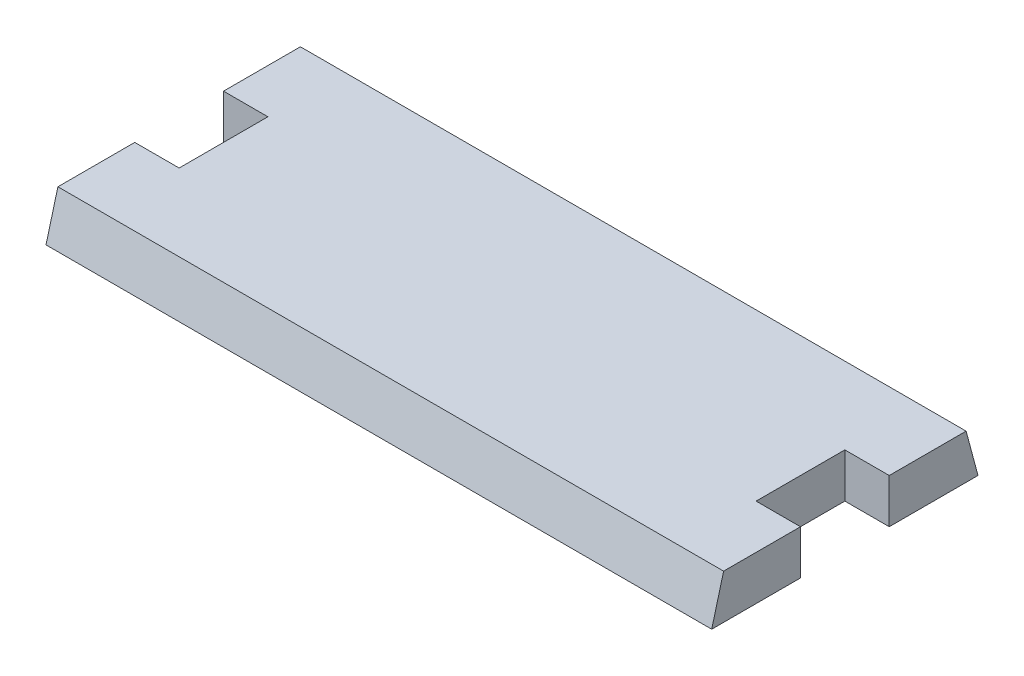
from build123d import *

# Parameters (mm, degrees)
BOSS_EXTRUDE1_DEPTH = 254
DRAFT1_ANGLE        = -15


with BuildPart() as part:
    # Sketch2 → Boss-Extrude1 (new body)
    with BuildSketch(Plane(origin=(0, 0, 0), x_dir=(1, 0, 0), z_dir=(0, 1, 0))):
        Polygon((-3810, -1016), (-3810, -1524), (0, -1524), (0, -1016), (-254, -1016), (-254, -508), (0, -508), (0, 0), (-3810, 0), (-3810, -508), (-3556, -508), (-3556, -1016), align=None)
    extrude(amount=BOSS_EXTRUDE1_DEPTH)

    # Draft1
    draft1_faces = [part.faces().sort_by_distance(p)[0] for p in [
        (-1905, 127, 0),
        (-1905, 127, 1524),
    ]]
    draft(draft1_faces, Plane(origin=(0, 0, 0), x_dir=(0, 0, -1), z_dir=(0, -1, 0)), DRAFT1_ANGLE)


solid = part.part
